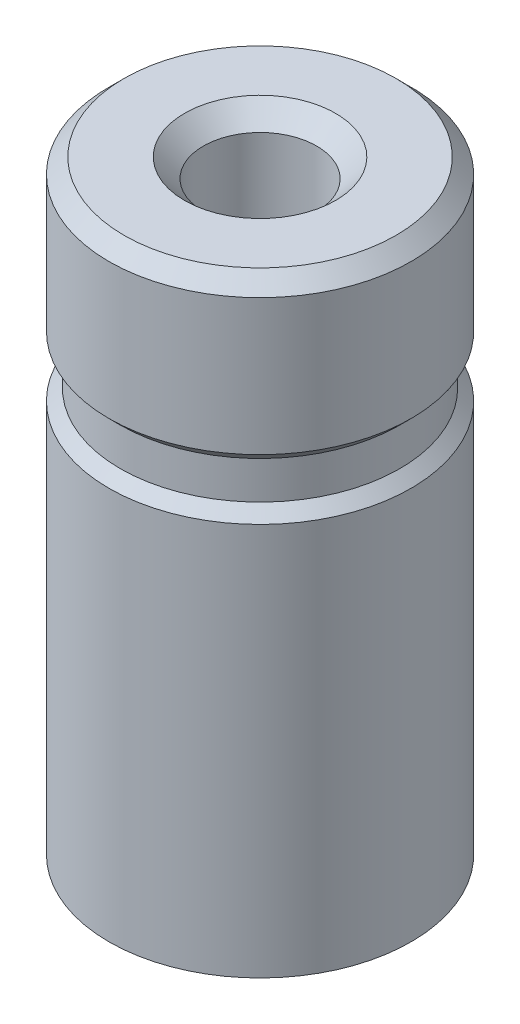
from build123d import *

# Parameters (mm, degrees)
SKETCH1_R           = 2
BOSS_EXTRUDE1_DEPTH = 5.2
SKETCH3_R           = 2
BOSS_EXTRUDE2_DEPTH = 0.15
BOSS_EXTRUDE2_TAPER = 45
SKETCH4_R           = 1.85
BOSS_EXTRUDE3_DEPTH = 0.5
SKETCH5_R           = 1.85
BOSS_EXTRUDE4_DEPTH = 0.15
BOSS_EXTRUDE4_DRAFT = -45
SKETCH6_R           = 2
BOSS_EXTRUDE5_DEPTH = 1.8
SKETCH7_R           = 2
BOSS_EXTRUDE6_DEPTH = 0.2
BOSS_EXTRUDE6_TAPER = 45
SKETCH11_R          = 1
CUT_EXTRUDE1_DEPTH  = 0.25
CUT_EXTRUDE1_DRAFT  = -45
SKETCH12_R          = 0.75
CUT_EXTRUDE2_DEPTH  = 4


with BuildPart() as part:
    # Sketch1 → Boss-Extrude1 (new body)
    with BuildSketch(Plane(origin=(0, 0, 0), x_dir=(1, 0, 0), z_dir=(0, 1, 0))):
        with Locations(Location((0, 0, 0), (0, 0, 270))):
            Circle(SKETCH1_R)
    extrude(amount=BOSS_EXTRUDE1_DEPTH)

    # Sketch3 → Boss-Extrude2 (add)
    with BuildSketch(Plane(origin=(0, 5.2, 0), x_dir=(1, 0, 0), z_dir=(0, 1, 0))):
        with Locations(Location((0, 0, 0), (0, 0, 270))):
            Circle(SKETCH3_R)
    extrude(amount=BOSS_EXTRUDE2_DEPTH, taper=BOSS_EXTRUDE2_TAPER)

    # Sketch4 → Boss-Extrude3 (add)
    with BuildSketch(Plane(origin=(0, 5.35, 0), x_dir=(1, 0, 0), z_dir=(0, 1, 0))):
        with Locations(Location((0, 0, 0), (0, 0, 270))):
            Circle(SKETCH4_R)
    extrude(amount=BOSS_EXTRUDE3_DEPTH)


with BuildPart() as boss_extrude4_tool:
    # Sketch5 → Boss-Extrude4 (with draft: the straight prism first)
    with BuildSketch(Plane(origin=(0, 5.85, 0), x_dir=(1, 0, 0), z_dir=(0, 1, 0))):
        with Locations(Location((0, 0, 0), (0, 0, 270))):
            Circle(SKETCH5_R)
    extrude(amount=BOSS_EXTRUDE4_DEPTH)
    # Boss-Extrude4: the draft: its side faces are tilted about the plane it starts from
    boss_extrude4_sides = [boss_extrude4_tool.faces().sort_by_distance(p)[0] for p in [
        (0, 5.925, -1.85),
    ]]
    draft(boss_extrude4_sides, Plane(origin=(0, 5.85, 0), x_dir=(1, 0, 0), z_dir=(0, 1, 0)), BOSS_EXTRUDE4_DRAFT)


with BuildPart() as part_1:
    add(part.part)

    # Boss-Extrude4: add boss_extrude4_tool
    add(boss_extrude4_tool.part)

    # Sketch6 → Boss-Extrude5 (add)
    with BuildSketch(Plane(origin=(0, 6, 0), x_dir=(1, 0, 0), z_dir=(0, 1, 0))):
        with Locations(Location((0, 0, 0), (0, 0, 270))):
            Circle(SKETCH6_R)
    extrude(amount=BOSS_EXTRUDE5_DEPTH)

    # Sketch7 → Boss-Extrude6 (add)
    with BuildSketch(Plane(origin=(0, 7.8, 0), x_dir=(1, 0, 0), z_dir=(0, 1, 0))):
        with Locations(Location((0, 0, 0), (0, 0, 270))):
            Circle(SKETCH7_R)
    extrude(amount=BOSS_EXTRUDE6_DEPTH, taper=BOSS_EXTRUDE6_TAPER)


with BuildPart() as cut_extrude1_tool:
    # Sketch11 → Cut-Extrude1 (with draft: the straight prism first)
    with BuildSketch(Plane(origin=(0, 8, 0), x_dir=(1, 0, 0), z_dir=(0, 1, 0))):
        Circle(SKETCH11_R)
    extrude(amount=-CUT_EXTRUDE1_DEPTH)
    # Cut-Extrude1: the draft: its side faces are tilted about the plane it starts from
    cut_extrude1_sides = [cut_extrude1_tool.faces().sort_by_distance(p)[0] for p in [
        (-1, 7.875, 0),
    ]]
    draft(cut_extrude1_sides, Plane(origin=(0, 8, 0), x_dir=(1, 0, 0), z_dir=(0, 1, 0)), CUT_EXTRUDE1_DRAFT)


with BuildPart() as part_2:
    add(part_1.part)

    # Cut-Extrude1: cut by cut_extrude1_tool
    add(cut_extrude1_tool.part, mode=Mode.SUBTRACT)

    # Sketch12 → Cut-Extrude2 (cut)
    with BuildSketch(Plane(origin=(0, 7.75, 0), x_dir=(1, 0, 0), z_dir=(0, 1, 0))):
        with Locations(Location((0, 0, 0), (0, 0, 270))):
            Circle(SKETCH12_R)
    extrude(amount=-CUT_EXTRUDE2_DEPTH, mode=Mode.SUBTRACT)


solid = part_2.part
